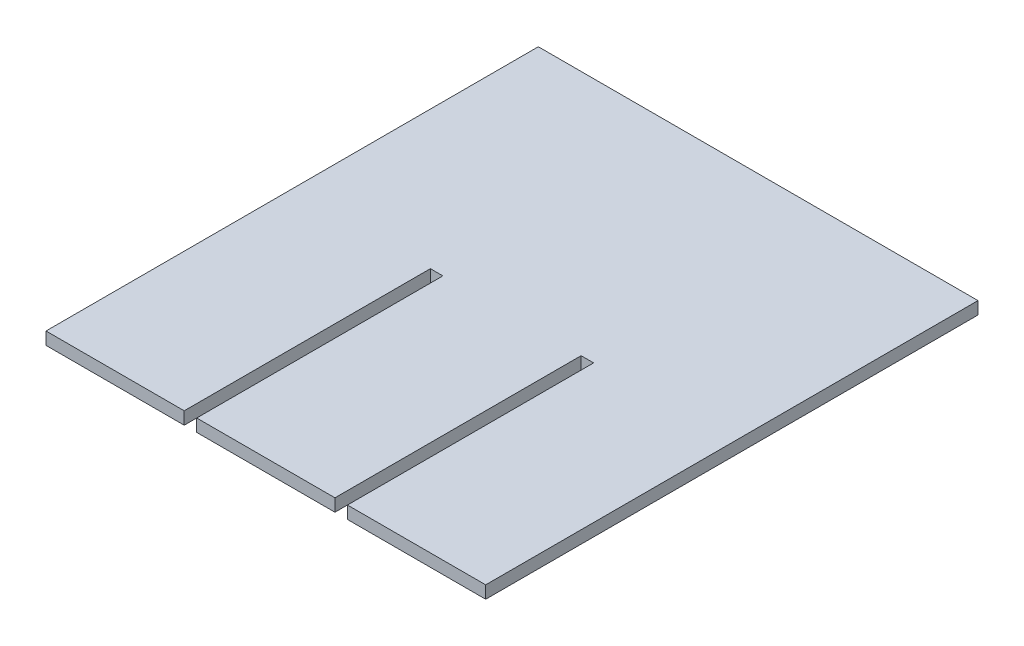
from build123d import *

# Parameters (mm, degrees)
BOSS_EXTRUDE1_DEPTH = 9.525


with BuildPart() as part:
    # Sketch1 → Boss-Extrude1 (new body)
    with BuildSketch(Plane(origin=(0, 0, 0), x_dir=(1, 0, 0), z_dir=(0, 1, 0))):
        Polygon((0, 375), (0, 0), (105.283333333, 0), (105.283333333, 187.5), (114.808333333, 187.5), (114.808333333, 0), (220.091666667, 0), (220.091666667, 187.5), (229.616666667, 187.5), (229.616666667, 0), (334.9, 0), (334.9, 375), align=None)
    extrude(amount=BOSS_EXTRUDE1_DEPTH)


solid = part.part
